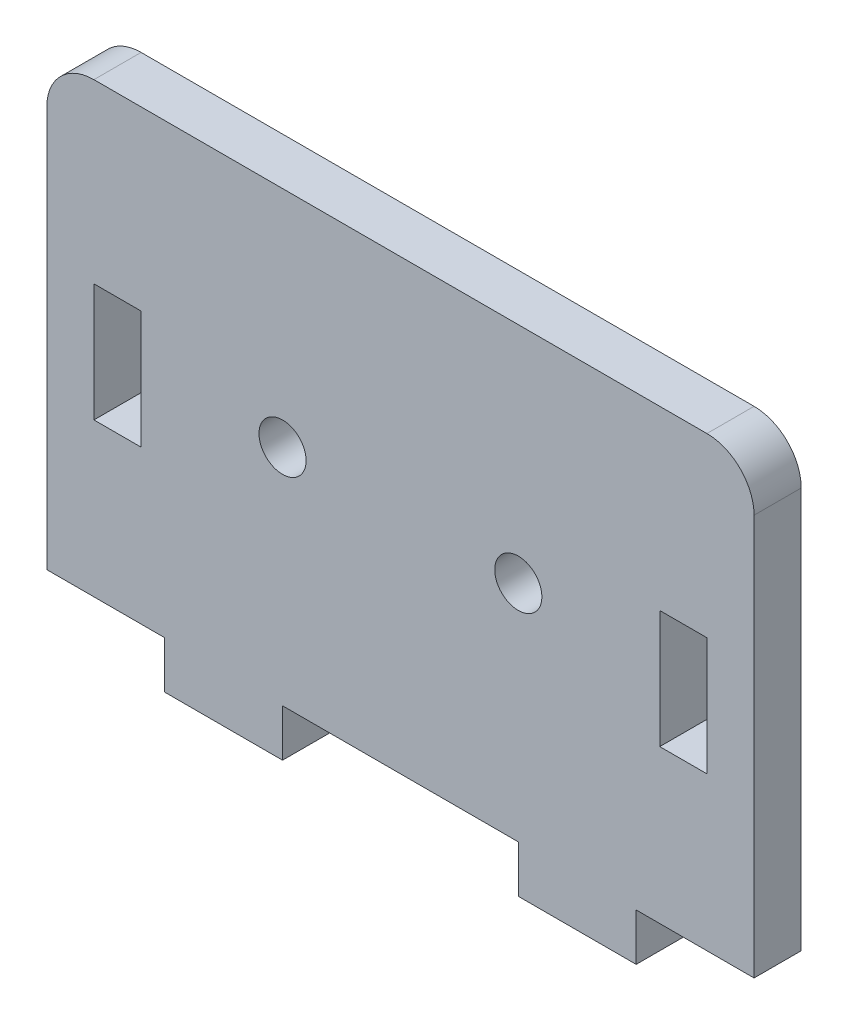
from build123d import *

# Parameters (mm, degrees)
SKETCH1_R           = 2
SKETCH1_W           = 4
SKETCH1_H           = 10
BOSS_EXTRUDE1_DEPTH = 4


with BuildPart() as part:
    # Sketch1 → Boss-Extrude1 (new body)
    with BuildSketch(Plane.XY):
        with BuildLine():
            Line((-30, -19), (-20, -19))
            Line((-20, -19), (-20, -23))
            Line((-20, -23), (-10, -23))
            Line((-10, -23), (-10, -19))
            Line((-10, -19), (10, -19))
            Line((10, -19), (10, -23))
            Line((10, -23), (20, -23))
            Line((20, -23), (20, -19))
            Line((20, -19), (30, -19))
            Line((30, -19), (30, 15))
            ThreePointArc((30, 15), (28.828427125, 17.828427125), (26, 19))
            Line((26, 19), (-26, 19))
            ThreePointArc((-26, 19), (-28.828427125, 17.828427125), (-30, 15))
            Line((-30, 15), (-30, -19))
        make_face()
        with Locations((-10, 0)):
            Circle(SKETCH1_R, mode=Mode.SUBTRACT)
        with Locations((10, 0)):
            Circle(SKETCH1_R, mode=Mode.SUBTRACT)
        with Locations((-24, -1)):
            Rectangle(SKETCH1_W, SKETCH1_H, mode=Mode.SUBTRACT)
        with Locations((24, -1)):
            Rectangle(SKETCH1_W, SKETCH1_H, mode=Mode.SUBTRACT)
    extrude(amount=BOSS_EXTRUDE1_DEPTH)


solid = part.part
